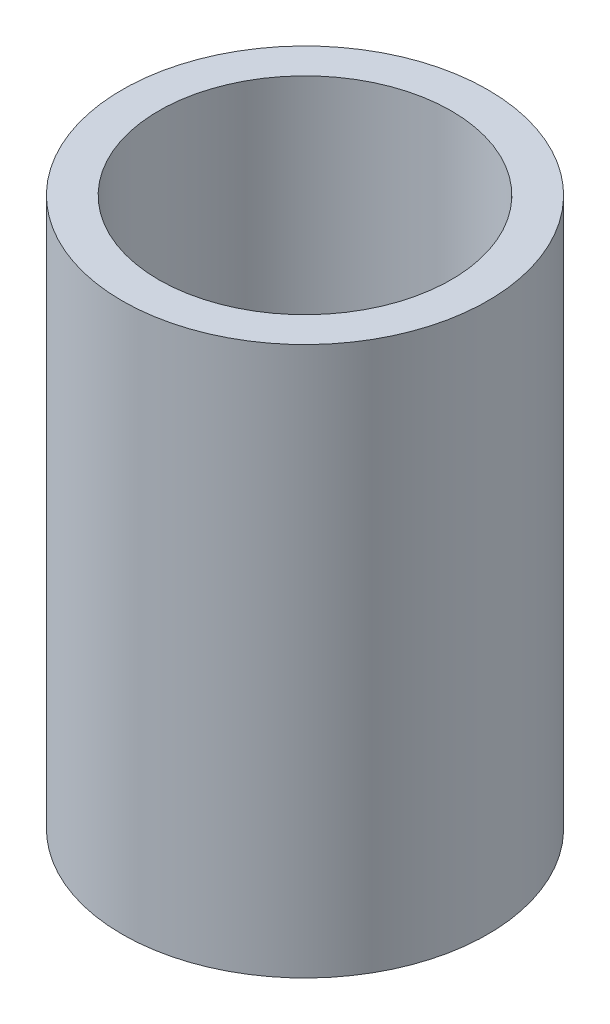
from build123d import *

# Parameters (mm, degrees)
SKETCH_1_R      = 50
SKETCH_1_R_2    = 40
EXTRUDE_1_DEPTH = 150


with BuildPart() as part:
    # Эскиз1 → Бобышка-Вытянуть1 (new body)
    with BuildSketch(Plane(origin=(0, 0, 0), x_dir=(1, 0, 0), z_dir=(0, 1, 0))):
        with Locations(Location((0, 0, 0), (0, 0, 270))):
            Circle(SKETCH_1_R)
        with Locations(Location((0, 0, 0), (0, 0, 270))):
            Circle(SKETCH_1_R_2, mode=Mode.SUBTRACT)
    extrude(amount=EXTRUDE_1_DEPTH)


solid = part.part
